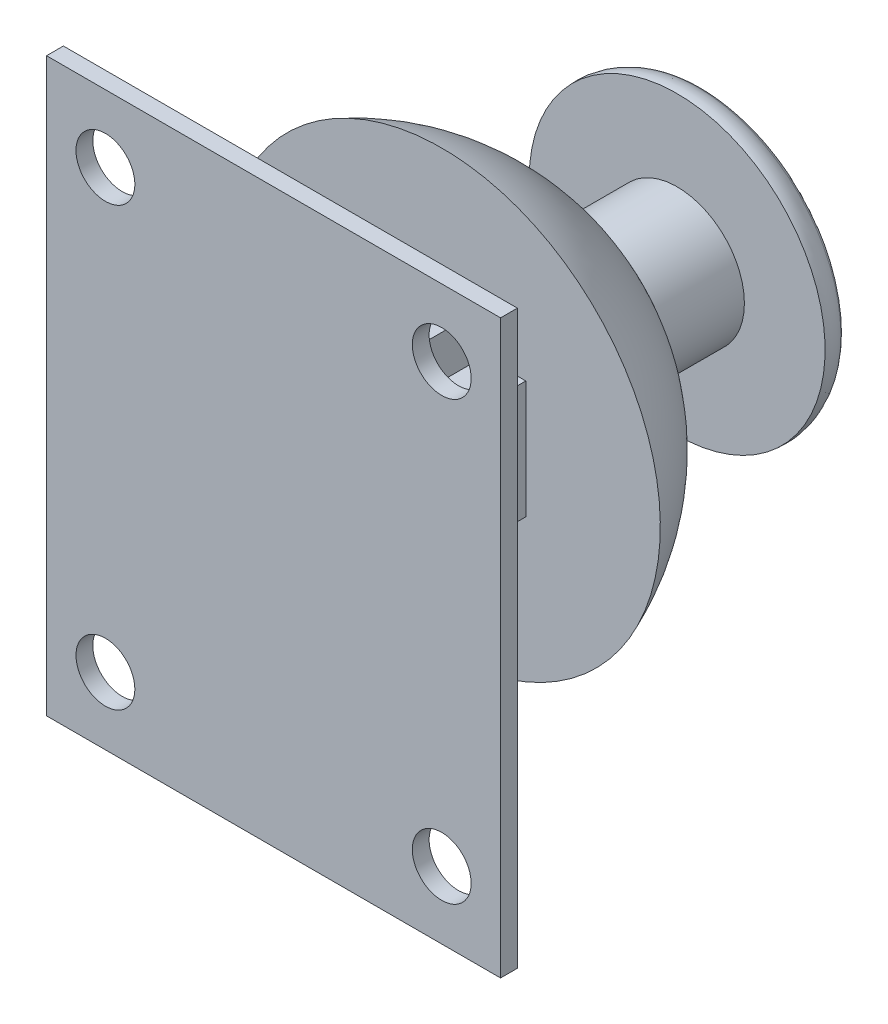
from build123d import *

# Parameters (mm, degrees)
SKETCH_1_W      = 27
SKETCH_1_H      = 34
SKETCH_1_R      = 1.75
EXTRUDE_1_DEPTH = 1
EXTRUDE_2_DEPTH = 10
SKETCH_4_R      = 4
EXTRUDE_3_DEPTH = 6
FILLET_1_R      = 1


with BuildPart() as part:
    # 草图1 → 凸台-拉伸1 (new body)
    with BuildSketch(Plane.XY):
        Rectangle(SKETCH_1_W, SKETCH_1_H)
        with Locations((10, 13)):
            Circle(SKETCH_1_R, mode=Mode.SUBTRACT)
        with Locations(Location((-10, 13, 0), (0, 0, 180))):
            Circle(SKETCH_1_R, mode=Mode.SUBTRACT)
        with Locations(Location((10, -13, 0), (0, 0, 180))):
            Circle(SKETCH_1_R, mode=Mode.SUBTRACT)
        with Locations((-10, -13)):
            Circle(SKETCH_1_R, mode=Mode.SUBTRACT)
    extrude(amount=EXTRUDE_1_DEPTH)

    # 草图2 → 凸台-拉伸2 (add)
    with BuildSketch(Plane(origin=(0, 0, 0), x_dir=(-1, 0, 0), z_dir=(0, 0, -1))):
        Polygon((12, 0), (12, 3.5), (9.5, 3.5), (9.5, 6), (-1.5, 6), (-1.5, 3.5), (-4, 3.5), (-4, -3.5), (-1.5, -3.5), (-1.5, -6), (9.5, -6), (9.5, -3.5), (12, -3.5), align=None)
    extrude(amount=EXTRUDE_2_DEPTH)

    # 草图3 → 旋转1 (revolve)
    with BuildSketch(Plane(origin=(-1, 0, 0), x_dir=(0, 0, -1), z_dir=(1, 0, 0))):
        with BuildLine():
            Line((10, -13), (10, 0))
            Line((10, 0), (18.803847577, 0))
            ThreePointArc((18.803847577, 0), (16.395787318, -7.850282354), (10, -13))
        make_face()
    revolve(axis=Axis((-1, 0, -17.702001311), (0, 0, 1)))

    # 草图4 → 凸台-拉伸3 (add)
    with BuildSketch(Plane.XY.offset(-18)):
        with Locations((-1, 0)):
            Circle(SKETCH_4_R)
    extrude(amount=-EXTRUDE_3_DEPTH)

    # 草图5 → 旋转3 (revolve)
    with BuildSketch(Plane(origin=(-1, 0, 0), x_dir=(0, 0, -1), z_dir=(1, 0, 0)), mode=Mode.PRIVATE) as revolve_3_sk:
        with BuildLine():
            Line((24, 0), (24, -8.8))
            ThreePointArc((24, -8.8), (24.807839272, -8.723517815), (25.5, -8.3))
            ThreePointArc((25.5, -8.3), (26.666937336, -4.225350121), (27, 0))
            Line((27, 0), (24, 0))
        make_face()
    revolve(revolve_3_sk.sketch.rotate(Axis((-1, 0, -28.967381471), (0, 0, 1)), 270), axis=Axis((-1, 0, -28.967381471), (0, 0, 1)))

    # 圆角1
    fillet_1_edges = [part.edges().sort_by_distance(p)[0] for p in [
        (7.3, 0, -25.5),
    ]]
    fillet(fillet_1_edges, radius=FILLET_1_R)


solid = part.part
